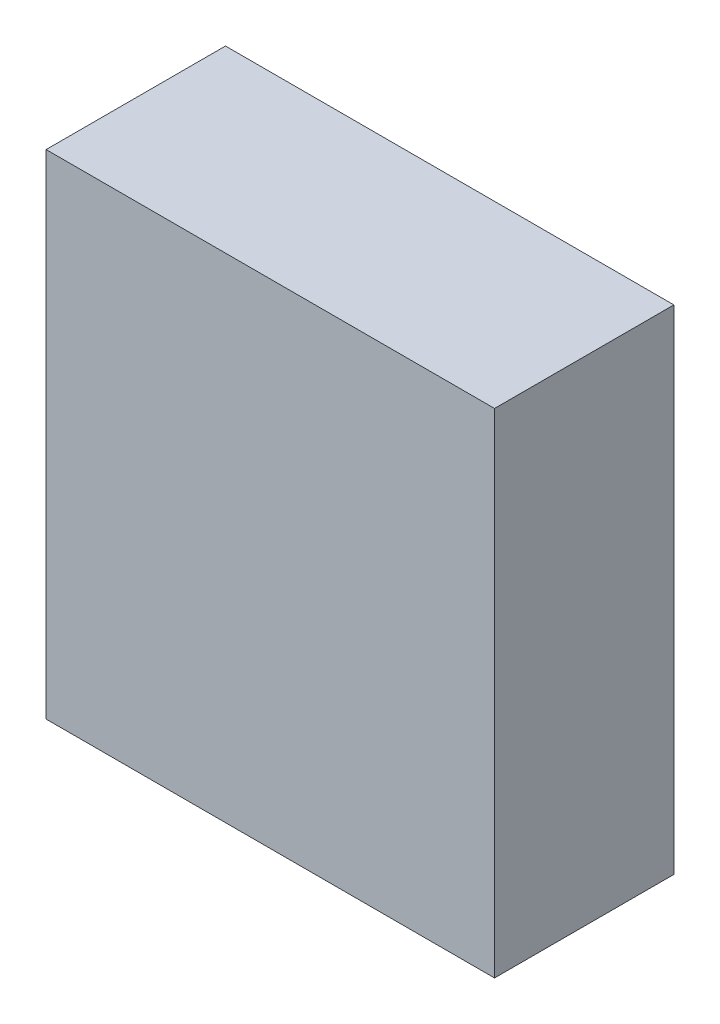
from build123d import *

# Parameters (mm, degrees)
TOPPING_ARKA_DUVAR_PANO_GUC_KAYNAGI_1_START = -736
SKETCH1_W                                   = 100
SKETCH1_H                                   = 110
TOPPING_ARKA_DUVAR_PANO_GUC_KAYNAGI_1_DEPTH = 40


with BuildPart() as part:
    # Sketch1 → TOPPING_arka_duvar_pano_guc_kaynagi_1 (new body)
    with BuildSketch(Plane.XY.offset(TOPPING_ARKA_DUVAR_PANO_GUC_KAYNAGI_1_START)):
        with Locations((290, 615)):
            Rectangle(SKETCH1_W, SKETCH1_H)
    extrude(amount=-TOPPING_ARKA_DUVAR_PANO_GUC_KAYNAGI_1_DEPTH)


solid = part.part
